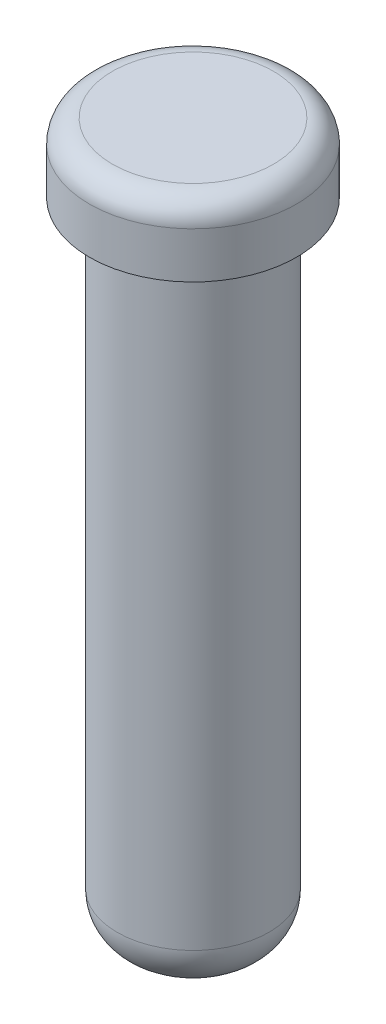
from build123d import *

# Parameters (mm, degrees)
SKETCH1_R           = 1.65
BOSS_EXTRUDE1_DEPTH = 14
SKETCH2_R           = 2.25
BOSS_EXTRUDE2_DEPTH = 1.5
FILLET1_R           = 0.5
FILLET2_R           = 1


with BuildPart() as part:
    # Sketch1 → Boss-Extrude1 (new body)
    with BuildSketch(Plane(origin=(0, 0, 0), x_dir=(1, 0, 0), z_dir=(0, 1, 0))):
        with Locations(Location((0, 0, 0), (0, 0, 270))):
            Circle(SKETCH1_R)
    extrude(amount=BOSS_EXTRUDE1_DEPTH)

    # Sketch2 → Boss-Extrude2 (add)
    with BuildSketch(Plane(origin=(0, 14, 0), x_dir=(1, 0, 0), z_dir=(0, 1, 0))):
        with Locations(Location((0, 0, 0), (0, 0, 270))):
            Circle(SKETCH2_R)
    extrude(amount=BOSS_EXTRUDE2_DEPTH)

    # Fillet1
    fillet1_edges = [part.edges().sort_by_distance(p)[0] for p in [
        (0, 15.5, -2.25),
    ]]
    fillet(fillet1_edges, radius=FILLET1_R)

    # Fillet2
    fillet2_edges = [part.edges().sort_by_distance(p)[0] for p in [
        (0, 0, -1.65),
    ]]
    fillet(fillet2_edges, radius=FILLET2_R)


solid = part.part
